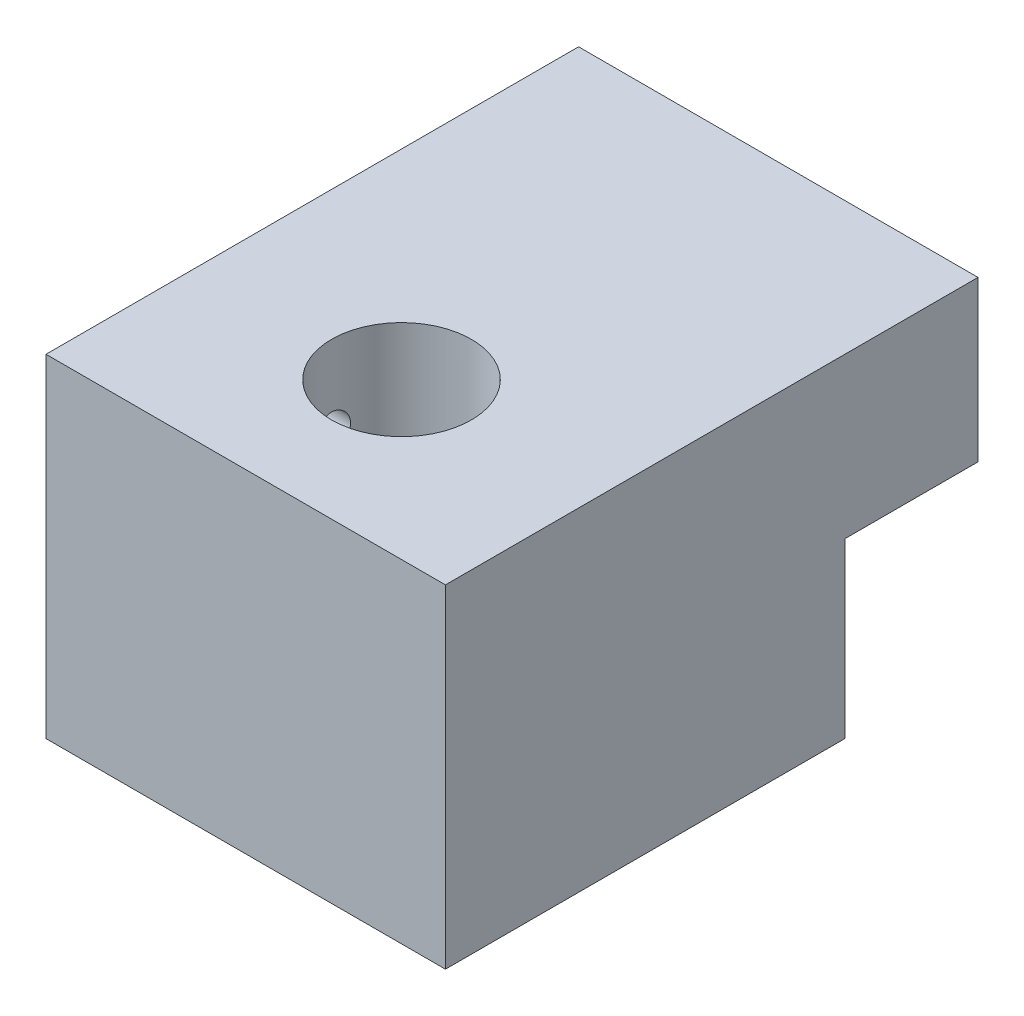
from build123d import *

# Parameters (mm, degrees)
SKETCH1_W                 = 30
SKETCH1_H                 = 12
BOSS_EXTRUDE1_DEPTH       = 40
SKETCH2_R                 = 5.25
CUT_EXTRUDE1_DEPTH        = 45.373415465
F_8_32_TAPPED_HOLE1_D     = 2.54
F_8_32_TAPPED_HOLE1_DEPTH = 10
F_8_32_TAPPED_HOLE1_TIP   = 0.763092986
SKETCH10_W                = 30
SKETCH10_H                = 30
SKETCH10_R                = 5.25
BOSS_EXTRUDE2_DEPTH       = 13
F_8_32_TAPPED_HOLE2_D     = 2.54
F_8_32_TAPPED_HOLE2_DEPTH = 10.71
F_8_32_TAPPED_HOLE2_TIP   = 0.763092986


with BuildPart() as part:
    # Sketch1 → Boss-Extrude1 (new body)
    with BuildSketch(Plane.XY):
        Rectangle(SKETCH1_W, SKETCH1_H)
    extrude(amount=BOSS_EXTRUDE1_DEPTH)

    # Sketch2 → Cut-Extrude1 (cut, through all)
    with BuildSketch(Plane(origin=(0, 6, 0), x_dir=(1, 0, 0), z_dir=(0, 1, 0))):
        with Locations(Location((0, -28.3, 0), (0, 0, 270))):
            Circle(SKETCH2_R)
    extrude(amount=-CUT_EXTRUDE1_DEPTH, mode=Mode.SUBTRACT)

    # #8-32 Tapped Hole1
    with Locations(Plane(origin=(0, 0, 0), x_dir=(-1, 0, 0), z_dir=(0, 0, -1))):
        with Locations((10, 0), (-10, 0)):
            Hole(F_8_32_TAPPED_HOLE1_D / 2, depth=F_8_32_TAPPED_HOLE1_DEPTH)
            with Locations((0, 0, -(F_8_32_TAPPED_HOLE1_DEPTH + F_8_32_TAPPED_HOLE1_TIP / 2))):  # 118° drill point
                Cone(0, F_8_32_TAPPED_HOLE1_D / 2, F_8_32_TAPPED_HOLE1_TIP, mode=Mode.SUBTRACT)

    # Sketch10 → Boss-Extrude2 (add)
    with BuildSketch(Plane.XZ.offset(6)):
        with Locations((0, 25)):
            Rectangle(SKETCH10_W, SKETCH10_H)
        with Locations(Location((0, 28.3, 0), (0, 0, 90))):
            Circle(SKETCH10_R, mode=Mode.SUBTRACT)
    extrude(amount=BOSS_EXTRUDE2_DEPTH)

    # #8-32 Tapped Hole2
    with Locations(Plane.ZY.offset(15)):
        with Locations((28.3, 0), (28.3, -12)):
            Hole(F_8_32_TAPPED_HOLE2_D / 2, depth=F_8_32_TAPPED_HOLE2_DEPTH)
            with Locations((0, 0, -(F_8_32_TAPPED_HOLE2_DEPTH + F_8_32_TAPPED_HOLE2_TIP / 2))):  # 118° drill point
                Cone(0, F_8_32_TAPPED_HOLE2_D / 2, F_8_32_TAPPED_HOLE2_TIP, mode=Mode.SUBTRACT)


solid = part.part
